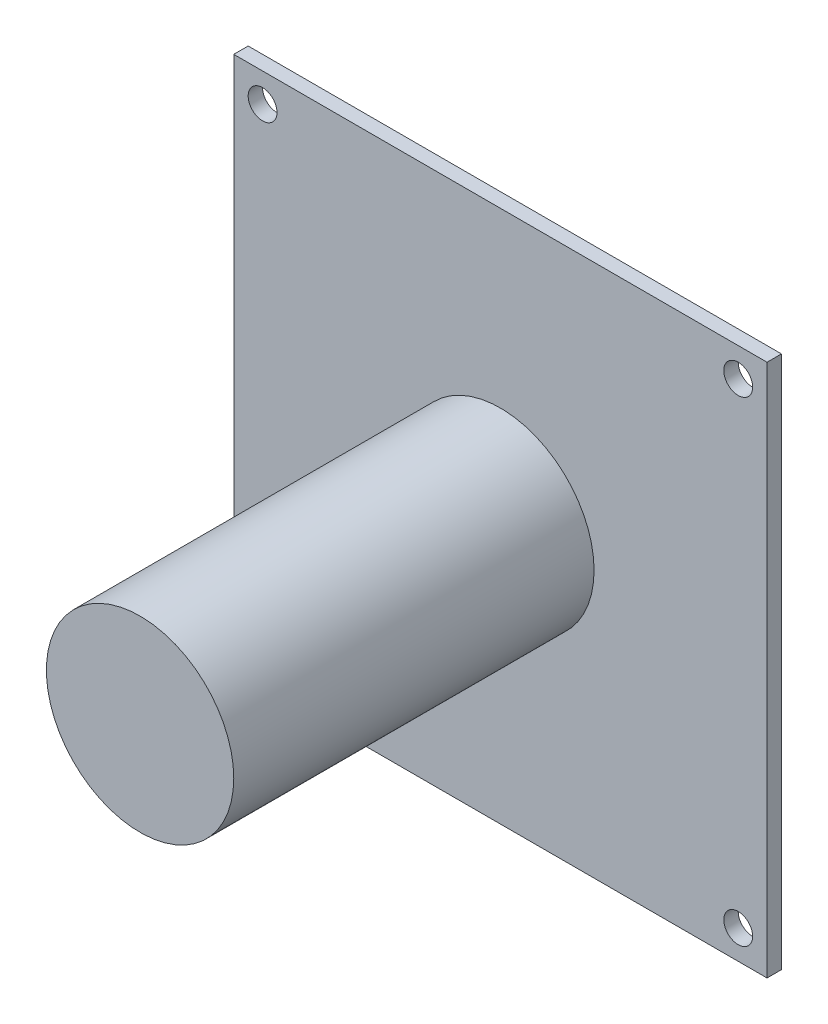
from build123d import *

# Parameters (mm, degrees)
MEASURED_PCB_37X37_W                                = 37
MEASURED_PCB_37X37_H                                = 37
PCB_VISUAL_THICKNESS_1MM_UNMEASURED_DEPTH           = 1
LENS_HEIGHT25_FROM_PCB_FRONT_START                  = 1
LENS_OD13_CENTER_PROVISIONAL_R                      = 6.5
LENS_HEIGHT25_FROM_PCB_FRONT_DEPTH                  = 25
FOUR_MEASURED_D2_HOLES_PROVISIONAL_LOCAT_DEPTH      = 37.884956283
FOUR_MEASURED_D2_HOLES_PROVISIONAL_LOCAT_DEPTH_BACK = 37.884956283
HOLE_CENTERS33_PROVISIONAL_R                        = 1


with BuildPart() as part:
    # Measured_PCB_37x37 → PCB_visual_thickness_1mm_UNMEASURED (new body)
    with BuildSketch(Plane.XY):
        Rectangle(MEASURED_PCB_37X37_W, MEASURED_PCB_37X37_H)
    extrude(amount=PCB_VISUAL_THICKNESS_1MM_UNMEASURED_DEPTH)

    # Lens_OD13_center_PROVISIONAL → Lens_height25_from_PCB_front (add)
    with BuildSketch(Plane.XY.offset(LENS_HEIGHT25_FROM_PCB_FRONT_START)):
        Circle(LENS_OD13_CENTER_PROVISIONAL_R)
    extrude(amount=LENS_HEIGHT25_FROM_PCB_FRONT_DEPTH)

    # Hole_centers33_PROVISIONAL → Four_measured_D2_holes_PROVISIONAL_locations (cut, two sides: drawn at the far end of the back side and taken through both)
    with BuildSketch(Plane.XY.offset(-FOUR_MEASURED_D2_HOLES_PROVISIONAL_LOCAT_DEPTH_BACK)):
        with Locations((-16.5, -16.5)):
            Circle(HOLE_CENTERS33_PROVISIONAL_R)
        with Locations((-16.5, 16.5)):
            Circle(HOLE_CENTERS33_PROVISIONAL_R)
        with Locations((16.5, -16.5)):
            Circle(HOLE_CENTERS33_PROVISIONAL_R)
        with Locations((16.5, 16.5)):
            Circle(HOLE_CENTERS33_PROVISIONAL_R)
    extrude(amount=FOUR_MEASURED_D2_HOLES_PROVISIONAL_LOCAT_DEPTH + FOUR_MEASURED_D2_HOLES_PROVISIONAL_LOCAT_DEPTH_BACK, mode=Mode.SUBTRACT)


solid = part.part
